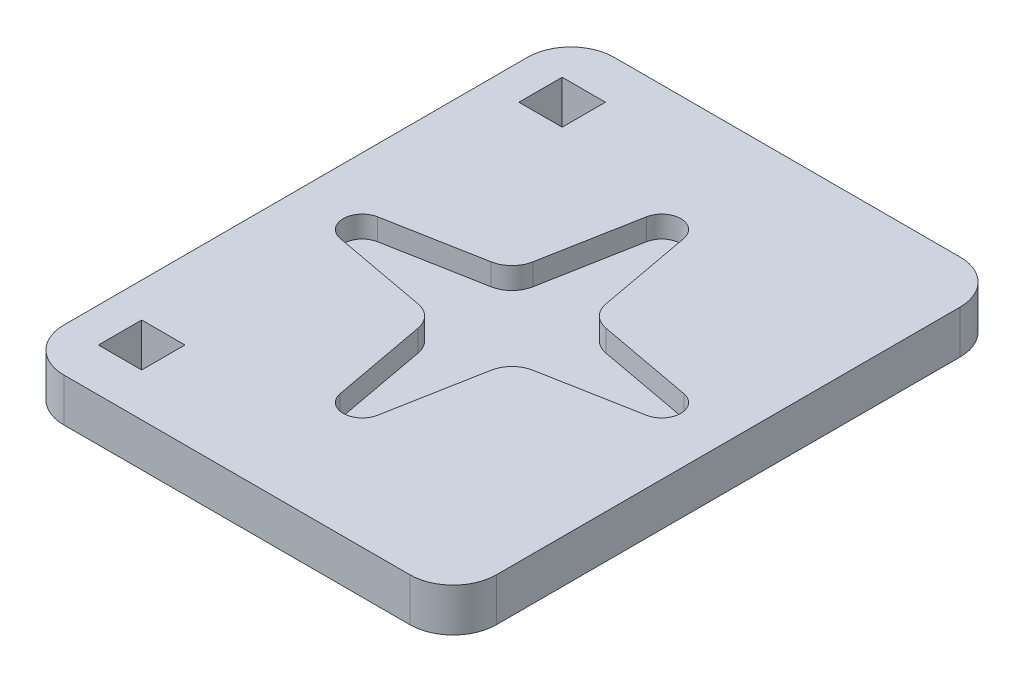
from build123d import *

# Parameters (mm, degrees)
SKETCH2_W           = 5
SKETCH2_H           = 5
BOSS_EXTRUDE1_DEPTH = 5
CUT_EXTRUDE1_DEPTH  = 2.5


with BuildPart() as part:
    # Sketch2 → Boss-Extrude1 (new body)
    with BuildSketch(Plane(origin=(0, 0, 0), x_dir=(1, 0, 0), z_dir=(0, 1, 0))):
        with BuildLine():
            Line((5, 0), (45, 0))
            ThreePointArc((45, 0), (48.535533906, -1.464466094), (50, -5))
            Line((50, -5), (50, -58.6))
            ThreePointArc((50, -58.6), (48.535533906, -62.135533906), (45, -63.6))
            Line((45, -63.6), (5, -63.6))
            ThreePointArc((5, -63.6), (1.464466094, -62.135533906), (0, -58.6))
            Line((0, -58.6), (0, -5))
            ThreePointArc((0, -5), (1.464466094, -1.464466094), (5, 0))
        make_face()
        with Locations((6.5, -56.1)):
            Rectangle(SKETCH2_W, SKETCH2_H, mode=Mode.SUBTRACT)
        with Locations((6.5, -7.5)):
            Rectangle(SKETCH2_W, SKETCH2_H, mode=Mode.SUBTRACT)
    extrude(amount=BOSS_EXTRUDE1_DEPTH)

    # Sketch4 → Cut-Extrude1 (cut)
    with BuildSketch(Plane(origin=(0, 5, 0), x_dir=(1, 0, 0), z_dir=(0, 1, 0))):
        with BuildLine():
            Line((18.377964167, -27.579927161), (7.298442774, -29.636968644))
            ThreePointArc((7.298442774, -29.636968644), (6.008366652, -30.393500731), (5.500039, -31.8))
            ThreePointArc((5.500039, -31.8), (6.008366652, -33.206499269), (7.298442774, -33.963031356))
            Line((7.298442774, -33.963031356), (18.377964167, -36.020072839))
            ThreePointArc((18.377964167, -36.020072839), (19.95165505, -36.84834495), (20.779927161, -38.422035833))
            Line((20.779927161, -38.422035833), (22.836968644, -49.501557226))
            ThreePointArc((22.836968644, -49.501557226), (25, -51.299961), (27.163031356, -49.501557226))
            Line((27.163031356, -49.501557226), (29.220072839, -38.422035833))
            ThreePointArc((29.220072839, -38.422035833), (30.04834495, -36.84834495), (31.622035833, -36.020072839))
            Line((31.622035833, -36.020072839), (42.701557226, -33.963031356))
            ThreePointArc((42.701557226, -33.963031356), (44.499961, -31.8), (42.701557226, -29.636968644))
            Line((42.701557226, -29.636968644), (31.622035833, -27.579927161))
            ThreePointArc((31.622035833, -27.579927161), (30.04834495, -26.75165505), (29.220072839, -25.177964167))
            Line((29.220072839, -25.177964167), (27.163031356, -14.098442774))
            ThreePointArc((27.163031356, -14.098442774), (25, -12.300039), (22.836968644, -14.098442774))
            Line((22.836968644, -14.098442774), (20.779927161, -25.177964167))
            ThreePointArc((20.779927161, -25.177964167), (19.95165505, -26.75165505), (18.377964167, -27.579927161))
        make_face()
    extrude(amount=-CUT_EXTRUDE1_DEPTH, mode=Mode.SUBTRACT)


solid = part.part
